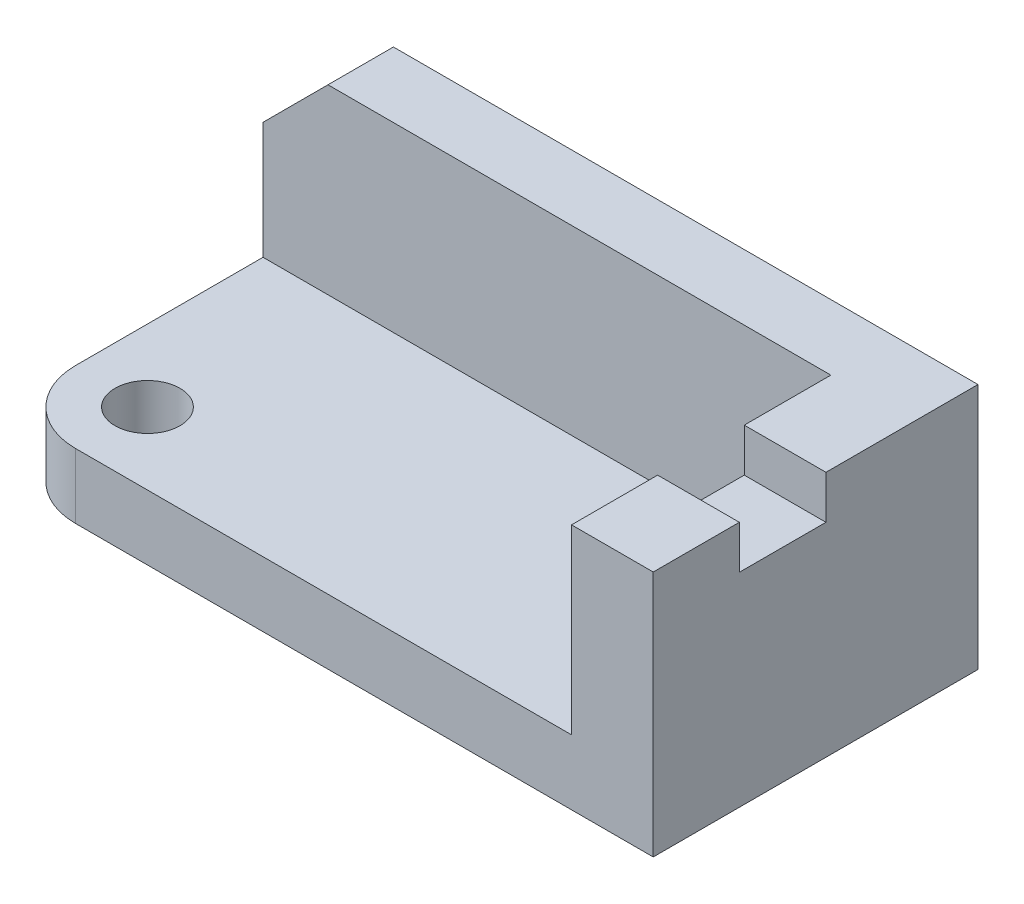
from build123d import *

# Parameters (mm, degrees)
SKETCH1_R           = 7.5
BOSS_EXTRUDE1_DEPTH = 15
BOSS_EXTRUDE2_DEPTH = 42
CHAMFER2_SIZE       = 15
SKETCH4_W           = 18.864791466
SKETCH4_H           = 20
CUT_EXTRUDE2_DEPTH  = 10


with BuildPart() as part:
    # Sketch1 → Boss-Extrude1 (new body)
    with BuildSketch(Plane(origin=(0, 0, 0), x_dir=(1, 0, 0), z_dir=(0, 1, 0))):
        with BuildLine():
            Line((-133.396551724, -75), (0, -75))
            Line((0, -75), (0, 0))
            Line((0, 0), (-150, 0))
            Line((-150, 0), (-150, -58.396551724))
            ThreePointArc((-150, -58.396551724), (-145.136962591, -70.136962591), (-133.396551724, -75))
        make_face()
        with Locations(Location((-133.396551724, -58.396551724, 0), (0, 0, 270))):
            Circle(SKETCH1_R, mode=Mode.SUBTRACT)
    extrude(amount=BOSS_EXTRUDE1_DEPTH)

    # Sketch3 → Boss-Extrude2 (add)
    with BuildSketch(Plane(origin=(0, 15, 0), x_dir=(1, 0, 0), z_dir=(0, 1, 0))):
        Polygon((0, 0), (-150, 0), (-150, -15.113333235), (-18.864791466, -15.113333235), (-18.864791466, -75), (0, -75), (0, -15.113333235), align=None)
    extrude(amount=BOSS_EXTRUDE2_DEPTH)

    # Chamfer2
    chamfer2_edges = [part.edges().sort_by_distance(p)[0] for p in [
        (-150, 57, 7.556666618),
    ]]
    chamfer(chamfer2_edges, length=CHAMFER2_SIZE)

    # Sketch4 → Cut-Extrude2 (cut)
    with BuildSketch(Plane(origin=(0, 57, 0), x_dir=(1, 0, 0), z_dir=(0, 1, 0))):
        with Locations((-9.432395733, -45.113333235)):
            Rectangle(SKETCH4_W, SKETCH4_H)
    extrude(amount=-CUT_EXTRUDE2_DEPTH, mode=Mode.SUBTRACT)


solid = part.part
